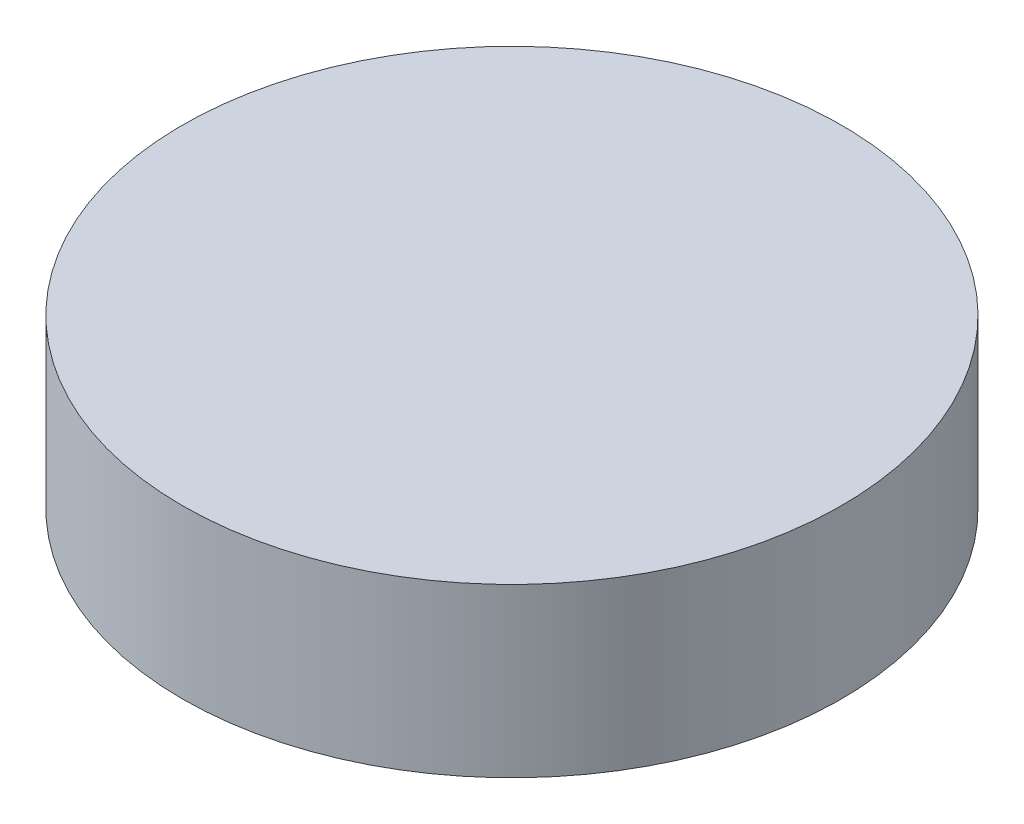
from build123d import *

# Parameters (mm, degrees)
SKETCH1_R           = 5
BOSS_EXTRUDE1_DEPTH = 2.54


with BuildPart() as part:
    # Sketch1 → Boss-Extrude1 (new body)
    with BuildSketch(Plane(origin=(0, 0, 0), x_dir=(1, 0, 0), z_dir=(0, 1, 0))):
        with Locations(Location((0, 0, 0), (0, 0, 270))):
            Circle(SKETCH1_R)
    extrude(amount=BOSS_EXTRUDE1_DEPTH)


solid = part.part
